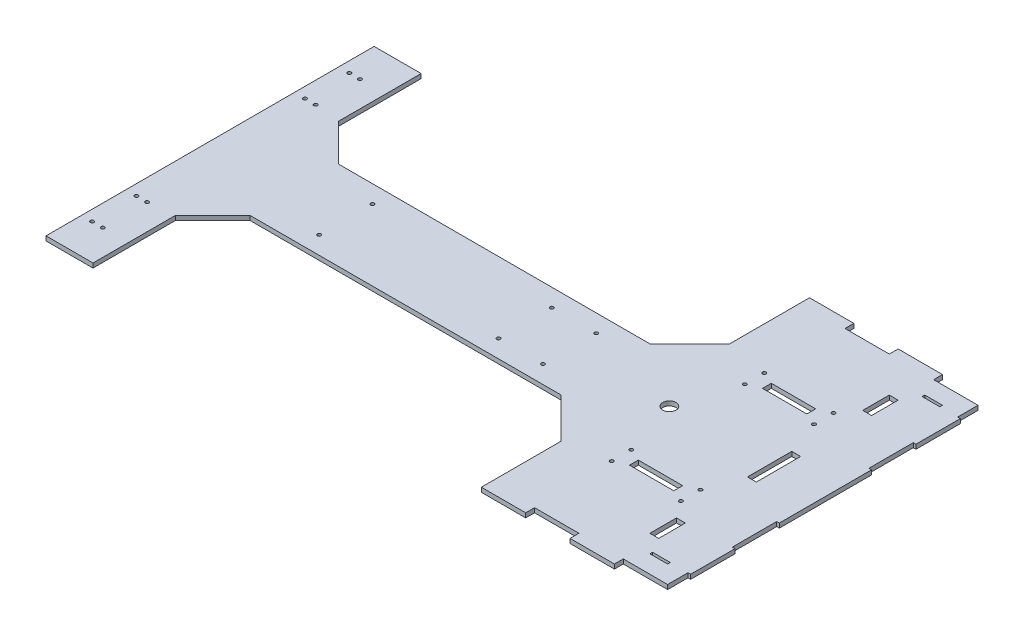
from build123d import *

# Parameters (mm, degrees)
EXTRUDE_1_DEPTH     = 5
SKETCH_2_W          = 20
SKETCH_2_H          = 3
SKETCH_2_W_2        = 10
SKETCH_2_H_2        = 30
SKETCH_2_H_3        = 50
CUT_EXTRUDE_1_DEPTH = 211.35683968
EXTRUDE_2_DEPTH     = 5
SKETCH_4_R          = 2
CUT_EXTRUDE_2_DEPTH = 620.212910153
SKETCH_6_W          = 3
SKETCH_6_H          = 50
SKETCH_6_H_2        = 104
EXTRUDE_3_DEPTH     = 5
EXTRUDE_4_DEPTH     = 5
SKETCH_8_R          = 2
SKETCH_8_W          = 50
SKETCH_8_H          = 10
CUT_EXTRUDE_3_DEPTH = 620.212910153
SKETCH_9_R          = 2
CUT_EXTRUDE_4_DEPTH = 620.212910153
SKETCH_10_R         = 7.5
CUT_EXTRUDE_5_DEPTH = 620.212910153


with BuildPart() as part:
    # 스케치1 → 보스-돌출1 (new body)
    with BuildSketch(Plane(origin=(0, 0, 0), x_dir=(1, 0, 0), z_dir=(0, 1, 0))):
        Polygon((-50, 175), (0, 175), (0, 185), (50, 185), (50, 175), (100, 175), (100, -175), (50, -175), (50, -185), (0, -185), (0, -175), (-50, -175), (-50, -185), (-100, -185), (-100, -175), (-100, 175), (-100, 185), (-50, 185), align=None)
    extrude(amount=EXTRUDE_1_DEPTH)

    # 스케치2 → 컷-돌출1 (cut, through all)
    with BuildSketch(Plane(origin=(0, 5, 0), x_dir=(1, 0, 0), z_dir=(0, 1, 0))):
        with Locations((70, 153.5)):
            Rectangle(SKETCH_2_W, SKETCH_2_H)
        with Locations((70, -153.5)):
            Rectangle(SKETCH_2_W, SKETCH_2_H)
        with Locations((45, 120)):
            Rectangle(SKETCH_2_W_2, SKETCH_2_H_2)
        with Locations((45, -120)):
            Rectangle(SKETCH_2_W_2, SKETCH_2_H_2)
        with Locations((45, 0)):
            Rectangle(SKETCH_2_W_2, SKETCH_2_H_3)
    extrude(amount=-CUT_EXTRUDE_1_DEPTH, mode=Mode.SUBTRACT)

    # 스케치3 → 보스-돌출2 (add)
    with BuildSketch(Plane(origin=(0, 5, 0), x_dir=(1, 0, 0), z_dir=(0, 1, 0))):
        Polygon((-540.91, 50), (-225, 50), (-100, 50), (-100, -50), (-225, -50), (-540.91, -50), (-540.91, -185), (-590.91, -185), (-590.91, 185), (-540.91, 185), align=None)
    extrude(amount=-EXTRUDE_2_DEPTH)

    # 스케치4 → 컷-돌출2 (cut, through all)
    with BuildSketch(Plane(origin=(0, 5, 0), x_dir=(1, 0, 0), z_dir=(0, 1, 0))):
        with Locations(Location((-578.91, 145, 0), (0, 0, 270))):
            Circle(SKETCH_4_R)
        with Locations(Location((-578.91, 95, 0), (0, 0, 270))):
            Circle(SKETCH_4_R)
        with Locations(Location((-566.91, 145, 0), (0, 0, 270))):
            Circle(SKETCH_4_R)
        with Locations(Location((-566.91, 95, 0), (0, 0, 270))):
            Circle(SKETCH_4_R)
        with Locations(Location((-578.91, -145, 0), (0, 0, 270))):
            Circle(SKETCH_4_R)
        with Locations(Location((-578.91, -95, 0), (0, 0, 270))):
            Circle(SKETCH_4_R)
        with Locations(Location((-566.91, -95, 0), (0, 0, 270))):
            Circle(SKETCH_4_R)
        with Locations(Location((-566.91, -145, 0), (0, 0, 270))):
            Circle(SKETCH_4_R)
    extrude(amount=-CUT_EXTRUDE_2_DEPTH, mode=Mode.SUBTRACT)

    # 스케치6 → 보스-돌출3 (add)
    with BuildSketch(Plane(origin=(0, 5, 0), x_dir=(1, 0, 0), z_dir=(0, 1, 0))):
        with Locations((101.5, -127)):
            Rectangle(SKETCH_6_W, SKETCH_6_H)
        with Locations((101.5, 127)):
            Rectangle(SKETCH_6_W, SKETCH_6_H)
        with Locations((101.5, 0)):
            Rectangle(SKETCH_6_W, SKETCH_6_H_2)
    extrude(amount=-EXTRUDE_3_DEPTH)

    # 스케치7 → 보스-돌출4 (add)
    with BuildSketch(Plane(origin=(0, 5, 0), x_dir=(1, 0, 0), z_dir=(0, 1, 0))):
        Polygon((-540.91, -185), (-537.91, -185), (-537.91, -92), (-495.91, -50), (-540.91, -50), align=None)
        Polygon((-537.91, 92), (-495.91, 50), (-540.91, 50), (-540.91, 185), (-537.91, 185), align=None)
        Polygon((-100, 95), (-145, 50), (-100, 50), align=None)
        Polygon((-100, -95), (-145, -50), (-100, -50), align=None)
    extrude(amount=-EXTRUDE_4_DEPTH)

    # 스케치8 → 컷-돌출3 (cut, through all)
    with BuildSketch(Plane(origin=(0, 5, 0), x_dir=(1, 0, 0), z_dir=(0, 1, 0))):
        with Locations(Location((-52, 86, 0), (0, 0, 270))):
            Circle(SKETCH_8_R)
        with Locations(Location((-52, 64, 0), (0, 0, 270))):
            Circle(SKETCH_8_R)
        with Locations(Location((26, 86, 0), (0, 0, 270))):
            Circle(SKETCH_8_R)
        with Locations(Location((26, 64, 0), (0, 0, 270))):
            Circle(SKETCH_8_R)
        with Locations(Location((-52, -86, 0), (0, 0, 90))):
            Circle(SKETCH_8_R)
        with Locations(Location((-52, -64, 0), (0, 0, 90))):
            Circle(SKETCH_8_R)
        with Locations(Location((26, -64, 0), (0, 0, 90))):
            Circle(SKETCH_8_R)
        with Locations(Location((26, -86, 0), (0, 0, 90))):
            Circle(SKETCH_8_R)
        with Locations((-13, 75)):
            Rectangle(SKETCH_8_W, SKETCH_8_H)
        with Locations((-13, -75)):
            Rectangle(SKETCH_8_W, SKETCH_8_H)
    extrude(amount=-CUT_EXTRUDE_3_DEPTH, mode=Mode.SUBTRACT)

    # 스케치9 → 컷-돌출4 (cut, through all)
    with BuildSketch(Plane(origin=(0, 5, 0), x_dir=(1, 0, 0), z_dir=(0, 1, 0))):
        with Locations(Location((-437.91, 30, 0), (0, 0, 270))):
            Circle(SKETCH_9_R)
        with Locations(Location((-235.58, 30, 0), (0, 0, 270))):
            Circle(SKETCH_9_R)
        with Locations(Location((-185.58, 30, 0), (0, 0, 270))):
            Circle(SKETCH_9_R)
        with Locations(Location((-185.58, -30, 0), (0, 0, 90))):
            Circle(SKETCH_9_R)
        with Locations(Location((-235.58, -30, 0), (0, 0, 90))):
            Circle(SKETCH_9_R)
        with Locations(Location((-437.91, -30, 0), (0, 0, 90))):
            Circle(SKETCH_9_R)
    extrude(amount=-CUT_EXTRUDE_4_DEPTH, mode=Mode.SUBTRACT)

    # 스케치10 → 컷-돌출5 (cut, through all)
    with BuildSketch(Plane(origin=(0, 5, 0), x_dir=(1, 0, 0), z_dir=(0, 1, 0))):
        with Locations(Location((-73, 0, 0), (0, 0, 270))):
            Circle(SKETCH_10_R)
    extrude(amount=-CUT_EXTRUDE_5_DEPTH, mode=Mode.SUBTRACT)


solid = part.part
